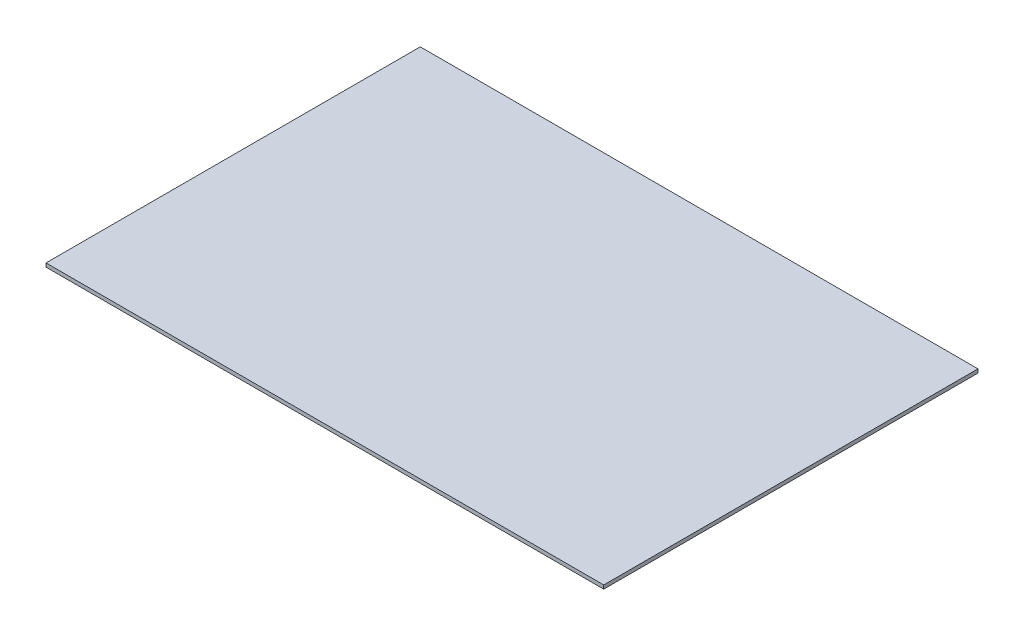
from build123d import *

# Parameters (mm, degrees)
SKETCH1_W           = 482.6
SKETCH1_H           = 323.85
BOSS_EXTRUDE1_DEPTH = 3.175


with BuildPart() as part:
    # Sketch1 → Boss-Extrude1 (new body)
    with BuildSketch(Plane(origin=(0, 0, 0), x_dir=(1, 0, 0), z_dir=(0, 1, 0))):
        with Locations((241.3, 161.925)):
            Rectangle(SKETCH1_W, SKETCH1_H)
    extrude(amount=BOSS_EXTRUDE1_DEPTH)


solid = part.part
